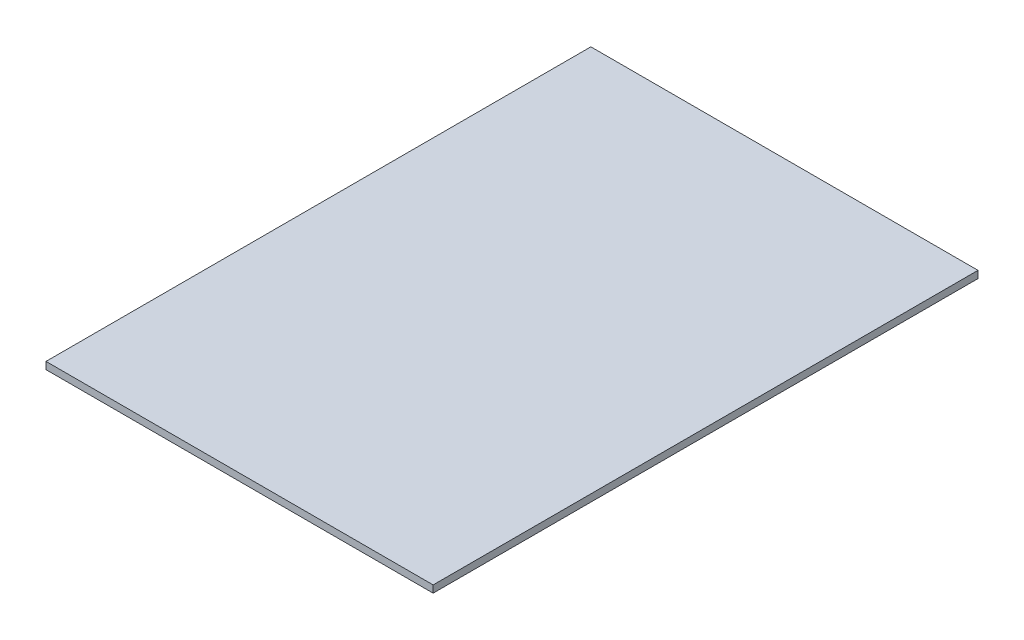
from build123d import *

# Parameters (mm, degrees)
SKETCH1_W           = 270
SKETCH1_H           = 5
BOSS_EXTRUDE1_DEPTH = 380


with BuildPart() as part:
    # Sketch1 → Boss-Extrude1 (new body)
    with BuildSketch(Plane.XY):
        with Locations((140, 47.5)):
            Rectangle(SKETCH1_W, SKETCH1_H)
    extrude(amount=BOSS_EXTRUDE1_DEPTH)


solid = part.part
